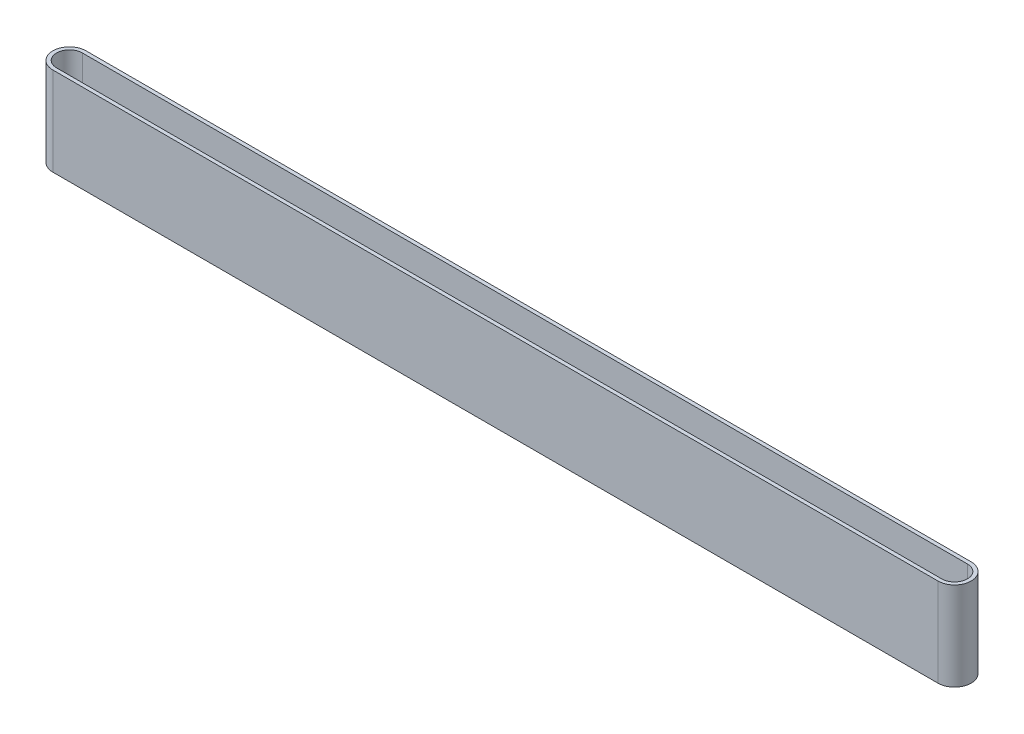
from build123d import *

# Parameters (mm, degrees)
BOSS_EXTRUDE1_DEPTH = 76.2


with BuildPart() as part:
    # Sketch1 → Boss-Extrude1 (new body)
    with BuildSketch(Plane(origin=(0, 0, 0), x_dir=(1, 0, 0), z_dir=(0, 1, 0))):
        with BuildLine():
            Line((0, 14.2875), (762, 14.2875))
            ThreePointArc((762, 14.2875), (776.2875, 0), (762, -14.2875))
            Line((762, -14.2875), (0, -14.2875))
            ThreePointArc((0, -14.2875), (-14.2875, 0), (0, 14.2875))
        make_face()
        with BuildLine():
            Line((0, 11.1125), (762, 11.1125))
            ThreePointArc((762, 11.1125), (773.1125, 0), (762, -11.1125))
            Line((762, -11.1125), (0, -11.1125))
            ThreePointArc((0, -11.1125), (-11.1125, 0), (0, 11.1125))
        make_face(mode=Mode.SUBTRACT)
    extrude(amount=BOSS_EXTRUDE1_DEPTH)


solid = part.part
